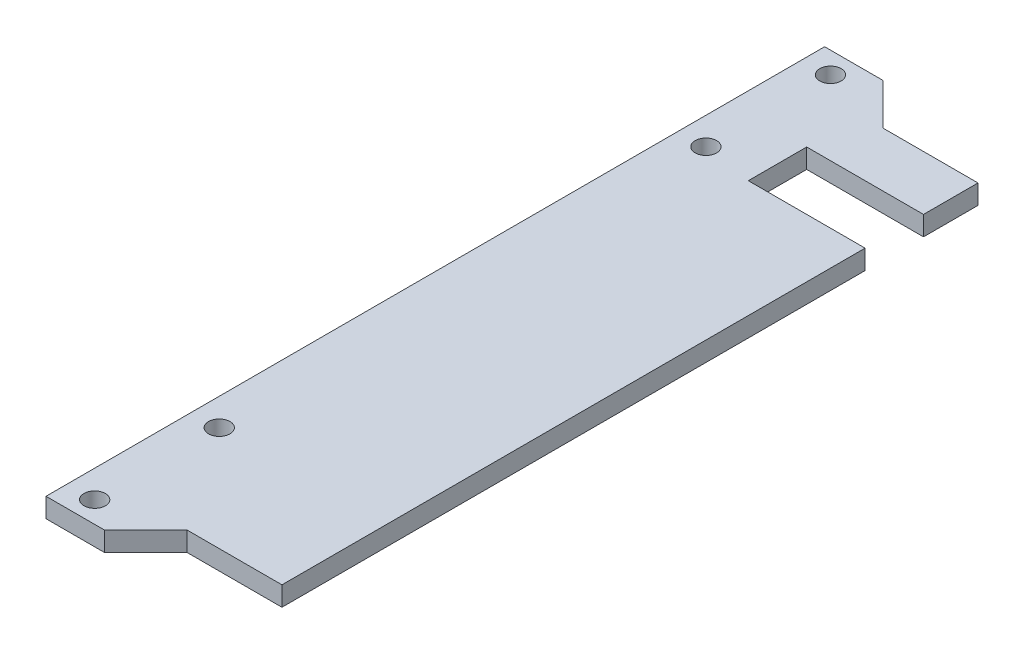
from build123d import *

# Parameters (mm, degrees)
ESQUISSE1_R             = 2.75
BOSS_EXTRU_1_DEPTH      = 5
ESQUISSE2_W             = 30
ESQUISSE2_H             = 15
ENL_V_MAT_EXTRU_1_DEPTH = 112.915146428


with BuildPart() as part:
    # Esquisse1 → Boss.-Extru.1 (new body)
    with BuildSketch(Plane(origin=(0, 0, 0), x_dir=(1, 0, 0), z_dir=(0, 1, 0))):
        Polygon((0, 100), (15, 100), (25.606601718, 89.393398282), (50, 89.393398282), (50, -89.393398282), (25.606601718, -89.393398282), (15, -100), (0, -100), align=None)
        with Locations(Location((7, 94.5, 0), (0, 0, 270))):
            Circle(ESQUISSE1_R, mode=Mode.SUBTRACT)
        with Locations(Location((7, 62.5, 0), (0, 0, 270))):
            Circle(ESQUISSE1_R, mode=Mode.SUBTRACT)
        with Locations(Location((7, -62.5, 0), (0, 0, 90))):
            Circle(ESQUISSE1_R, mode=Mode.SUBTRACT)
        with Locations(Location((7, -94.5, 0), (0, 0, 90))):
            Circle(ESQUISSE1_R, mode=Mode.SUBTRACT)
    extrude(amount=BOSS_EXTRU_1_DEPTH)

    # Esquisse2 → Enlèv. mat.-Extru.1 (cut, through all)
    with BuildSketch(Plane(origin=(0, 5, 0), x_dir=(1, 0, 0), z_dir=(0, 1, 0))):
        with Locations((35, 67.893398282)):
            Rectangle(ESQUISSE2_W, ESQUISSE2_H)
    extrude(amount=-ENL_V_MAT_EXTRU_1_DEPTH, mode=Mode.SUBTRACT)


solid = part.part
